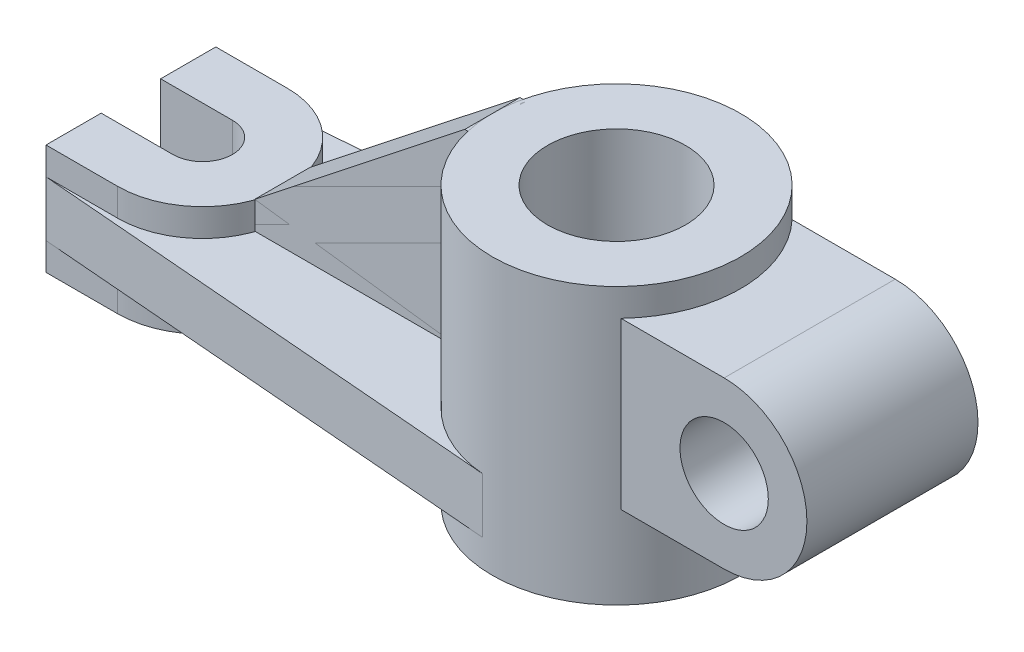
from build123d import *

# Parameters (mm, degrees)
SKETCH1_R               = 22.5
SKETCH1_R_2             = 12.5
BOSS_EXTRUDE1_DEPTH     = 50
BOSS_EXTRUDE2_DEPTH     = 20
BOSS_EXTRUDE4_START     = 5
BOSS_EXTRUDE4_DEPTH     = 10
BOSS_EXTRUDE5_START     = 15
BOSS_EXTRUDE5_DEPTH     = 30
BOSS_EXTRUDE9_DEPTH     = 5
BOSS_EXTRUDE10_DEPTH    = 31
CUT_EXTRUDE1_DEPTH      = 109.111054014
CUT_EXTRUDE1_DEPTH_BACK = 109.111054014
SKETCH13_R              = 8
BOSS_EXTRUDE11_DEPTH    = 5


with BuildPart() as part:
    # Sketch1 → Boss-Extrude1 (new body)
    with BuildSketch(Plane(origin=(0, 0, 0), x_dir=(1, 0, 0), z_dir=(0, 1, 0))):
        Circle(SKETCH1_R)
        Circle(SKETCH1_R_2, mode=Mode.SUBTRACT)
    extrude(amount=BOSS_EXTRUDE1_DEPTH)



with BuildPart() as body_2:
    # Sketch1<4> → Boss-Extrude2 (new body)
    with BuildSketch(Plane(origin=(0, 0, 0), x_dir=(1, 0, 0), z_dir=(0, 1, 0))):
        with BuildLine():
            ThreePointArc((-74.999999995, -15.38737848), (-59.61262152, 3e-09), (-75, 15.38737848))
            Line((-75, 15.38737848), (-88, 15.38737848))
            Line((-88, 15.38737848), (-88, 5.38737848))
            Line((-88, 5.38737848), (-75, 5.38737848))
            ThreePointArc((-75, 5.38737848), (-69.61262152, 0), (-75, -5.38737848))
            Line((-75, -5.38737848), (-87.999999995, -5.38737848))
            Line((-87.999999995, -5.38737848), (-87.999999995, -15.38737848))
            Line((-87.999999995, -15.38737848), (-74.999999995, -15.38737848))
        make_face()
    extrude(amount=BOSS_EXTRUDE2_DEPTH)


with BuildPart() as part_1:
    add(part.part)

    add(body_2.part)  # Boss-Extrude4 merges body 2
    # Sketch1<6> → Boss-Extrude4 (add)
    with BuildSketch(Plane(origin=(0, 0, 0), x_dir=(1, 0, 0), z_dir=(0, 1, 0)).offset(BOSS_EXTRUDE4_START)):
        with BuildLine():
            ThreePointArc((-1.831625627, -22.425323801), (-22.5, 0), (-1.831625627, 22.425323801))
            Line((-1.831625627, 22.425323801), (-88, 15.38737848))
            Line((-88, 15.38737848), (-75, 15.38737848))
            ThreePointArc((-75, 15.38737848), (-59.61262152, 3e-09), (-74.999999995, -15.38737848))
            Line((-74.999999995, -15.38737848), (-87.999999995, -15.38737848))
            Line((-87.999999995, -15.38737848), (-1.831625627, -22.425323801))
        make_face()
    extrude(amount=BOSS_EXTRUDE4_DEPTH)

    # Sketch1<7> → Boss-Extrude5 (add)
    with BuildSketch(Plane(origin=(0, 0, 0), x_dir=(1, 0, 0), z_dir=(0, 1, 0)).offset(BOSS_EXTRUDE5_START)):
        with BuildLine():
            ThreePointArc((16.30950643, 15.5), (22.5, 0), (16.30950643, -15.5))
            Line((16.30950643, -15.5), (35, -15.5))
            Line((35, -15.5), (35, 15.5))
            Line((35, 15.5), (16.30950643, 15.5))
        make_face()
    extrude(amount=BOSS_EXTRUDE5_DEPTH)

    # Sketch12 → Boss-Extrude10 (add)
    with BuildSketch(Plane.XY.offset(15.5)):
        with BuildLine():
            Line((35, 45), (35, 15))
            ThreePointArc((35, 15), (50, 30), (35, 45))
        make_face()
    extrude(amount=-BOSS_EXTRUDE10_DEPTH)

    # Sketch13 → Cut-Extrude1 (cut, two sides: drawn at the far end of the back side and taken through both)
    with BuildSketch(Plane.XY.offset(15.5).offset(-CUT_EXTRUDE1_DEPTH_BACK)):
        with Locations((35, 30)):
            Circle(SKETCH13_R)
    extrude(amount=CUT_EXTRUDE1_DEPTH + CUT_EXTRUDE1_DEPTH_BACK, mode=Mode.SUBTRACT)


with BuildPart() as body_2_2:
    # Sketch9 → Boss-Extrude9 (new, symmetric)
    with BuildSketch(Plane.XY):
        Polygon((-21.368534633, 50), (-22.5, 50), (-60.563403799, 20), (-60.563403799, 15), (-21.368534633, 15), align=None)
    extrude(amount=BOSS_EXTRUDE9_DEPTH, both=True)


with BuildPart() as body_3:
    # Sketch9<2> → Boss-Extrude11 (new, symmetric)
    with BuildSketch(Plane.XY):
        Polygon((-21.368534633, 50), (-22.5, 50), (-60.563403799, 20), (-60.563403799, 15), (-21.368534633, 15), align=None)
    extrude(amount=BOSS_EXTRUDE11_DEPTH, both=True)


solid = Compound([part_1.part, body_2_2.part, body_3.part])
